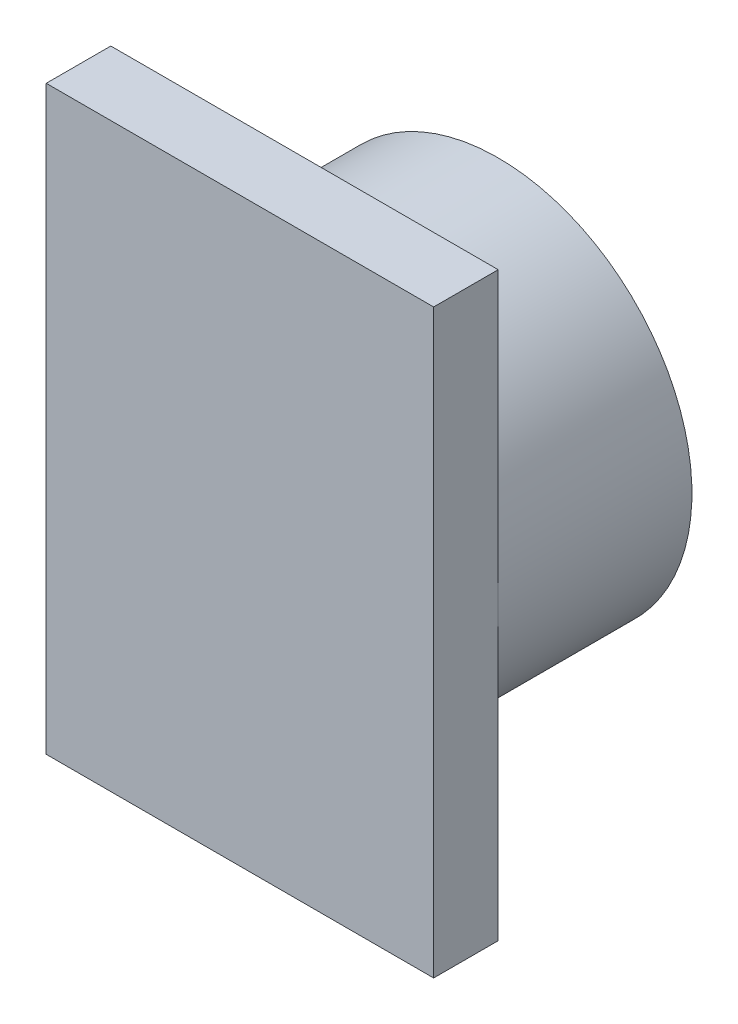
from build123d import *

# Parameters (mm, degrees)
SKETCH1_W           = 60
SKETCH1_H           = 90
BOSS_EXTRUDE1_DEPTH = 10
SKETCH2_R           = 30
BOSS_EXTRUDE2_DEPTH = 30


with BuildPart() as part:
    # Sketch1 → Boss-Extrude1 (new body)
    with BuildSketch(Plane.XY):
        Rectangle(SKETCH1_W, SKETCH1_H)
    extrude(amount=BOSS_EXTRUDE1_DEPTH)

    # Sketch2 → Boss-Extrude2 (add)
    with BuildSketch(Plane(origin=(0, 0, 0), x_dir=(-1, 0, 0), z_dir=(0, 0, -1))):
        Circle(SKETCH2_R)
        with BuildLine():
            Line((4, -13.912685387), (4, -13.325269778))
            ThreePointArc((4, -13.325269778), (0, 13.912685387), (-4, -13.325269778))
            Line((-4, -13.325269778), (-4, -13.912685387))
            Line((-4, -13.912685387), (-4, -16.912685387))
            Line((-4, -16.912685387), (4, -16.912685387))
            Line((4, -16.912685387), (4, -13.912685387))
        make_face(mode=Mode.SUBTRACT)
    extrude(amount=BOSS_EXTRUDE2_DEPTH)


solid = part.part
